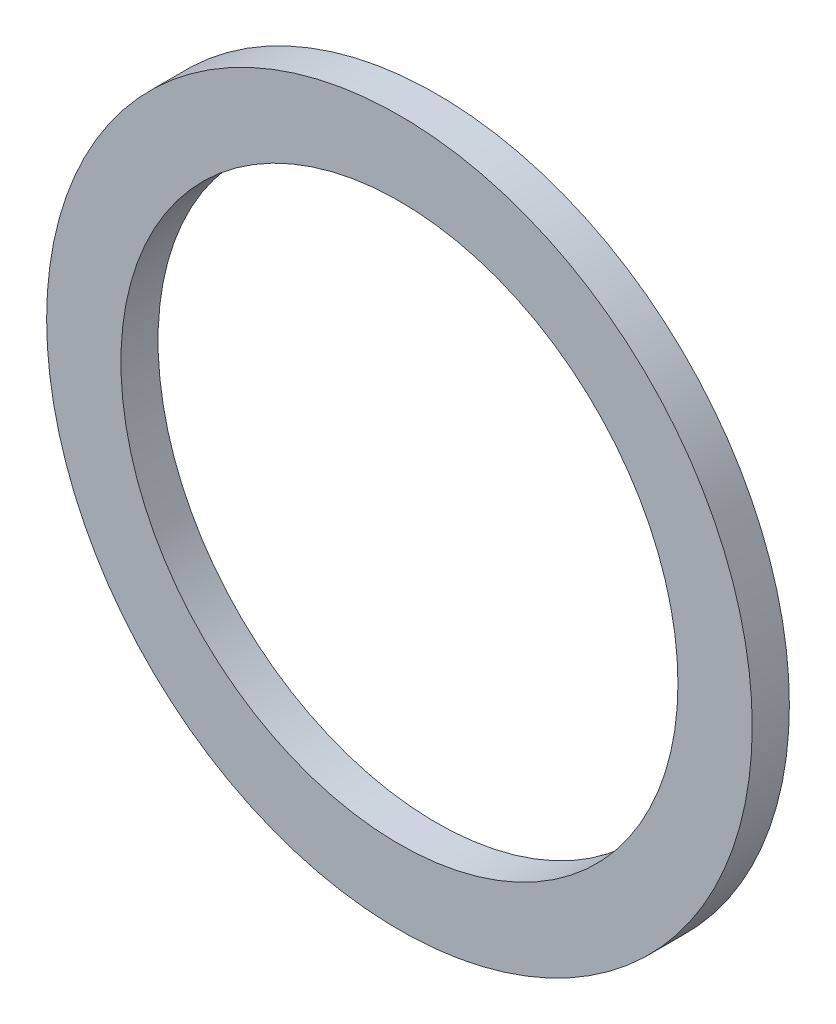
from build123d import *

# Parameters (mm, degrees)
ESQUISSE1_R      = 19
ESQUISSE1_R_2    = 15
EXTRUSION1_DEPTH = 2


with BuildPart() as part:
    # Esquisse1 → Extrusion1 (new body)
    with BuildSketch(Plane.XY):
        Circle(ESQUISSE1_R)
        Circle(ESQUISSE1_R_2, mode=Mode.SUBTRACT)
    extrude(amount=EXTRUSION1_DEPTH)


solid = part.part
